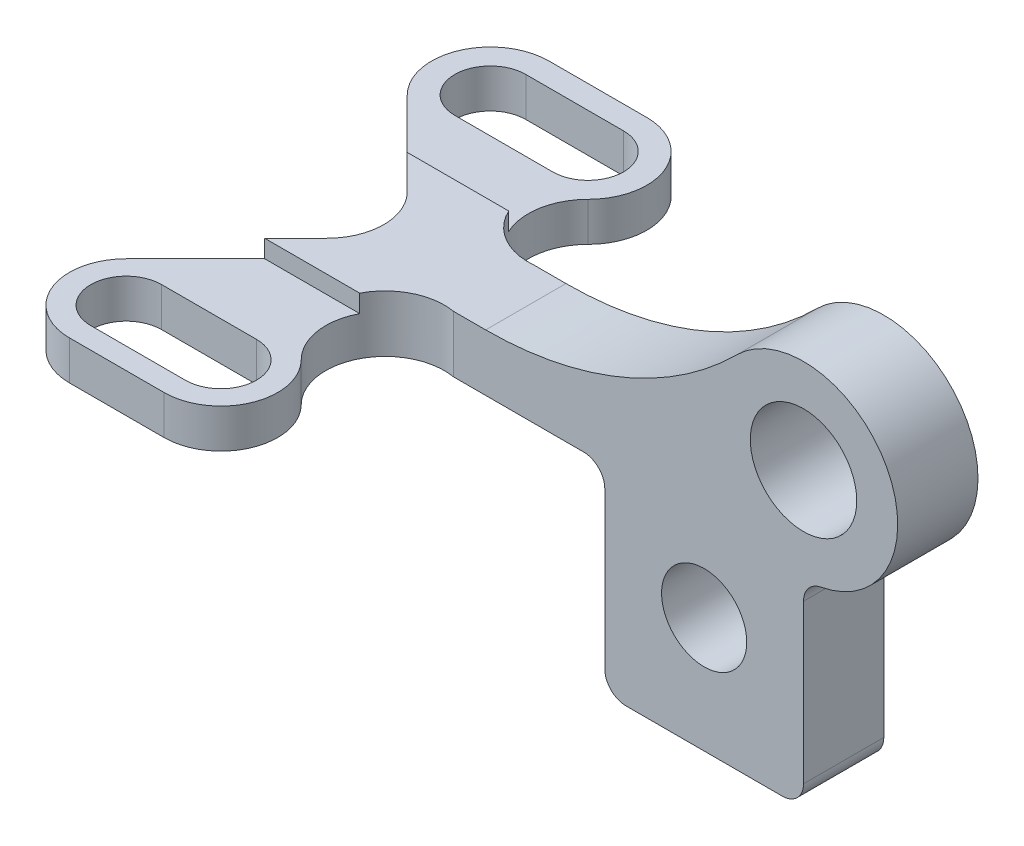
from build123d import *

# Parameters (mm, degrees)
BOSS_EXTRUDE1_DEPTH = 16
BOSS_EXTRUDE2_START = -22.627417
SKETCH2_R           = 12
SKETCH2_R_2         = 15
BOSS_EXTRUDE2_DEPTH = 22.627417
FILLET1_R           = 6
SKETCH6_W           = 59.235505044
SKETCH6_H           = 5
CUT_EXTRUDE3_DEPTH  = 46.82239
SKETCH9_W           = 60.661911653
SKETCH9_H           = 5
CUT_EXTRUDE4_DEPTH  = 47.281077


with BuildPart() as part:
    # Sketch1 → Boss-Extrude1 (new body)
    with BuildSketch(Plane(origin=(0, 0, 0), x_dir=(1, 0, 0), z_dir=(0, 1, 0))):
        with BuildLine():
            Line((-46.084327379, 32.649418524), (-18.51965158, 32.649418524))
            ThreePointArc((-18.51965158, 32.649418524), (-3.230722186, 22.433682506), (-6.818011624, 4.399160642))
            ThreePointArc((-6.818011624, 4.399160642), (-10.165791884, -14.631658747), (6.580056768, -24.273042062))
            Line((6.580056768, -24.273042062), (89.580056768, -24.273042062))
            Line((89.580056768, -24.273042062), (89.580056768, -46.90045906))
            Line((89.580056768, -46.90045906), (6.580056768, -46.90045906))
            ThreePointArc((6.580056768, -46.90045906), (-11.103107382, -55.676049041), (-8.083731763, -75.184730307))
            ThreePointArc((-8.083731763, -75.184730307), (-4.615367742, -92.621373724), (-19.397440262, -102.498438806))
            Line((-19.397440262, -102.498438806), (-46.084327379, -102.498438806))
            ThreePointArc((-46.084327379, -102.498438806), (-60.866399899, -92.621373724), (-57.398035878, -75.184730307))
            Line((-57.398035878, -75.184730307), (-29.113764631, -46.90045906))
            ThreePointArc((-29.113764631, -46.90045906), (-24.42747313, -35.586750561), (-29.113764631, -24.273042062))
            Line((-29.113764631, -24.273042062), (-57.785967334, 4.399160642))
            ThreePointArc((-57.785967334, 4.399160642), (-61.373256773, 22.433682506), (-46.084327379, 32.649418524))
        make_face()
        with BuildLine():
            Line((-46.084327379, 26.100800597), (-18.51965158, 26.100800597))
            ThreePointArc((-18.51965158, 26.100800597), (-8.51965158, 16.100800597), (-18.51965158, 6.100800597))
            Line((-18.51965158, 6.100800597), (-46.084327379, 6.100800597))
            ThreePointArc((-46.084327379, 6.100800597), (-56.084327379, 16.100800597), (-46.084327379, 26.100800597))
        make_face(mode=Mode.SUBTRACT)
        with BuildLine():
            Line((-46.084327379, -76.498438806), (-19.397440262, -76.498438806))
            ThreePointArc((-19.397440262, -76.498438806), (-9.397440262, -86.498438806), (-19.397440262, -96.498438806))
            Line((-19.397440262, -96.498438806), (-46.084327379, -96.498438806))
            ThreePointArc((-46.084327379, -96.498438806), (-56.084327379, -86.498438806), (-46.084327379, -76.498438806))
        make_face(mode=Mode.SUBTRACT)
    extrude(amount=BOSS_EXTRUDE1_DEPTH)

    # Sketch2 → Boss-Extrude2 (add)
    with BuildSketch(Plane.XY.offset(46.90045906).offset(BOSS_EXTRUDE2_START)):
        with BuildLine():
            Line((105.185672621, -56), (105.185672621, 0))
            ThreePointArc((105.185672621, 0), (129.714674209, 36.710245129), (86.41198758, 45.323685041))
            ThreePointArc((86.41198758, 45.323685041), (53.931590324, 23.620977443), (15.618349457, 16))
            Line((15.618349457, 16), (89.580056768, 16))
            Line((89.580056768, 16), (89.580056768, 0))
            Line((89.580056768, 0), (49.185672621, 0))
            Line((49.185672621, 0), (49.185672621, -56))
            Line((49.185672621, -56), (105.185672621, -56))
        make_face()
        with Locations((77.185672621, -23.45)):
            Circle(SKETCH2_R, mode=Mode.SUBTRACT)
        with Locations((105.185672621, 26.55)):
            Circle(SKETCH2_R_2, mode=Mode.SUBTRACT)
    extrude(amount=BOSS_EXTRUDE2_DEPTH)

    # Fillet1
    fillet1_edges = [part.edges().sort_by_distance(p)[0] for p in [
        (105.185672621, 0, 35.58675056),
        (105.185672621, -56, 35.58675056),
        (49.185672621, -56, 35.58675056),
        (49.185672621, 0, 35.58675056),
    ]]
    fillet(fillet1_edges, radius=FILLET1_R)

    # Sketch6 → Cut-Extrude3 (cut)
    with BuildSketch(Plane.XY.offset(102.498438806)):
        with Locations((-33.015192784, 13.5)):
            Rectangle(SKETCH6_W, SKETCH6_H)
    extrude(amount=-CUT_EXTRUDE3_DEPTH, mode=Mode.SUBTRACT)

    # Sketch9 → Cut-Extrude4 (cut)
    with BuildSketch(Plane(origin=(0, 0, -32.649418524), x_dir=(-1, 0, 0), z_dir=(0, 0, -1))):
        with Locations((32.30198948, 13.5)):
            Rectangle(SKETCH9_W, SKETCH9_H)
    extrude(amount=-CUT_EXTRUDE4_DEPTH, mode=Mode.SUBTRACT)


solid = part.part
